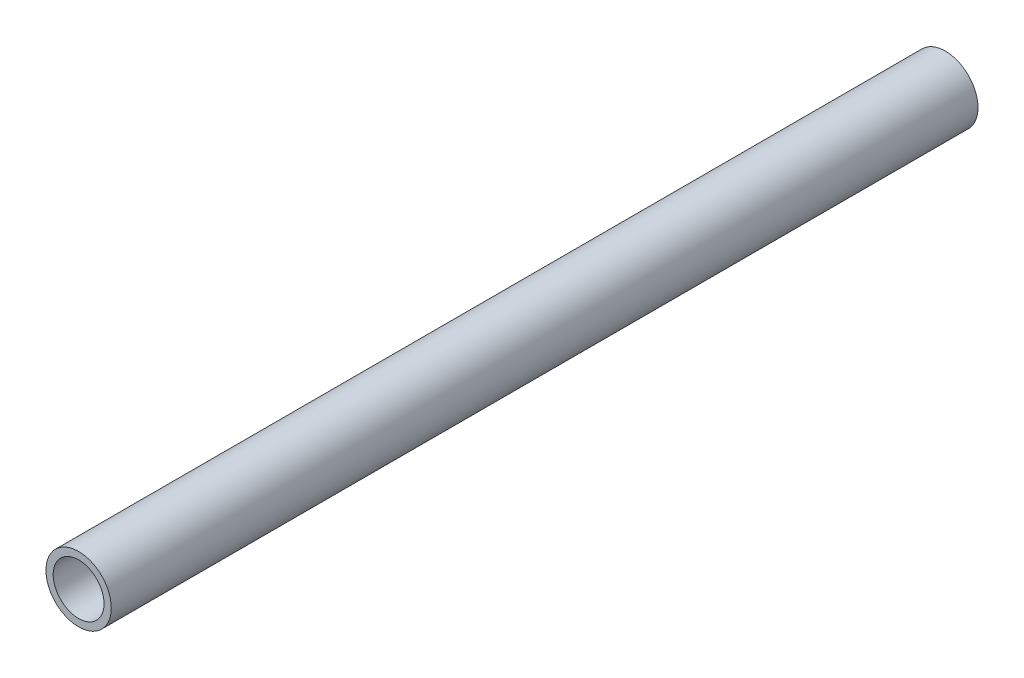
from build123d import *

# Parameters (mm, degrees)
SKETCH_1_R      = 9
SKETCH_1_R_2    = 7
EXTRUDE_1_DEPTH = 238.73


with BuildPart() as part:
    # 草图1 → 凸台-拉伸1 (new body)
    with BuildSketch(Plane.XY):
        Circle(SKETCH_1_R)
        Circle(SKETCH_1_R_2, mode=Mode.SUBTRACT)
    extrude(amount=EXTRUDE_1_DEPTH)


solid = part.part
